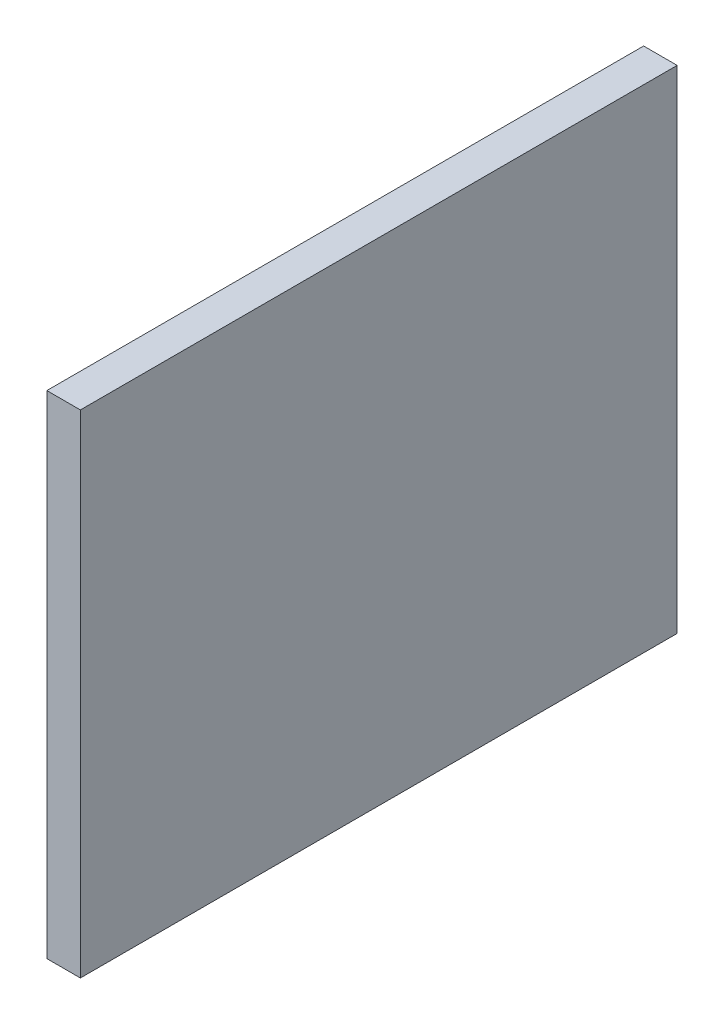
from build123d import *

# Parameters (mm, degrees)
SKETCH1_W           = 76.2
SKETCH1_H           = 1355.725
BOSS_EXTRUDE1_DEPTH = 1117.6


with BuildPart() as part:
    # Sketch1 → Boss-Extrude1 (new body)
    with BuildSketch(Plane(origin=(0, 0, 0), x_dir=(1, 0, 0), z_dir=(0, 1, 0))):
        with Locations((38.1, -677.8625)):
            Rectangle(SKETCH1_W, SKETCH1_H)
    extrude(amount=BOSS_EXTRUDE1_DEPTH)


solid = part.part
